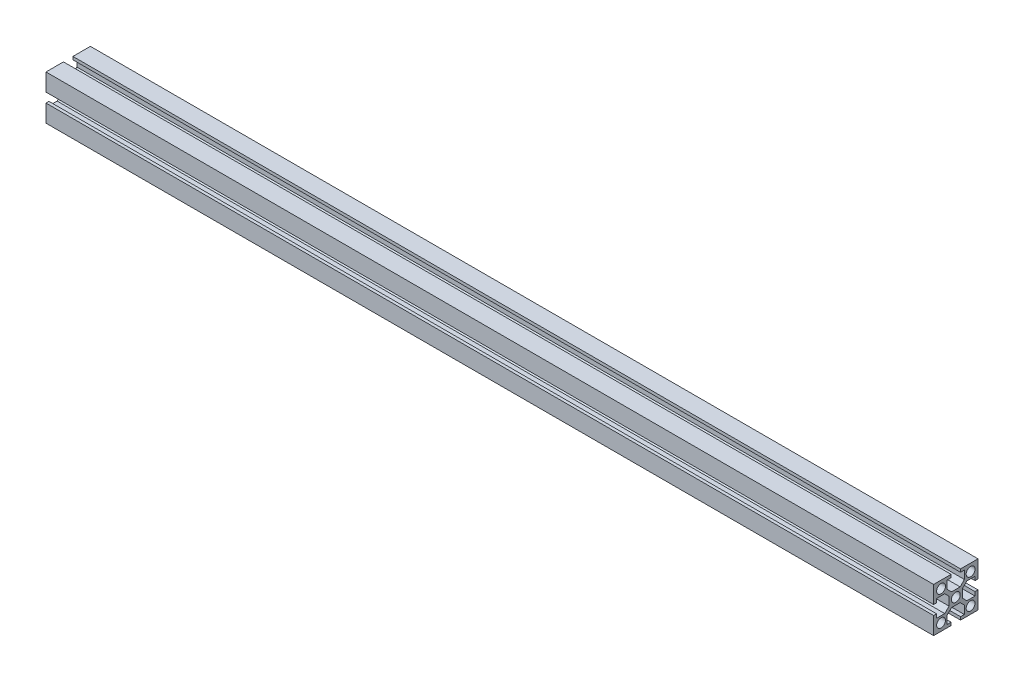
from build123d import *

# Parameters (mm, degrees)
SKETCH1_R           = 1.5
BOSS_EXTRUDE1_DEPTH = 300


with BuildPart() as part:
    # Sketch1 → Boss-Extrude1 (new body)
    with BuildSketch(Plane(origin=(-50, 0, 0), x_dir=(0, -1, 0), z_dir=(-1, 0, 0))):
        Polygon((5.2, -11.451471863), (3.751471863, -12.9), (1, -12.9), (1, -11.6), (0, -11.6), (0, -17.5), (5.9, -17.5), (5.9, -16.5), (4.6, -16.5), (4.6, -13.748528137), (6.048528137, -12.3), (8.951471863, -12.3), (10.4, -13.748528137), (10.4, -16.5), (9.1, -16.5), (9.1, -17.5), (15, -17.5), (15, -11.6), (14, -11.6), (14, -12.9), (11.248528137, -12.9), (9.8, -11.451471863), (9.8, -8.548528137), (11.248528137, -7.1), (14, -7.1), (14, -8.4), (15, -8.4), (15, -2.5), (9.1, -2.5), (9.1, -3.5), (10.4, -3.5), (10.4, -6.251471863), (8.951471863, -7.7), (6.048528137, -7.7), (4.6, -6.251471863), (4.6, -3.5), (5.9, -3.5), (5.9, -2.5), (0, -2.5), (0, -8.4), (1, -8.4), (1, -7.1), (3.751471863, -7.1), (5.2, -8.548528137), align=None)
        with Locations(Location((7.5, -10, 0), (0, 0, 270))):
            Circle(SKETCH1_R, mode=Mode.SUBTRACT)
        with Locations(Location((2.5, -5, 0), (0, 0, 270))):
            Circle(SKETCH1_R, mode=Mode.SUBTRACT)
        with Locations(Location((2.5, -15, 0), (0, 0, 270))):
            Circle(SKETCH1_R, mode=Mode.SUBTRACT)
        with Locations(Location((12.5, -5, 0), (0, 0, 270))):
            Circle(SKETCH1_R, mode=Mode.SUBTRACT)
        with Locations(Location((12.5, -15, 0), (0, 0, 270))):
            Circle(SKETCH1_R, mode=Mode.SUBTRACT)
    extrude(amount=-BOSS_EXTRUDE1_DEPTH)


solid = part.part
